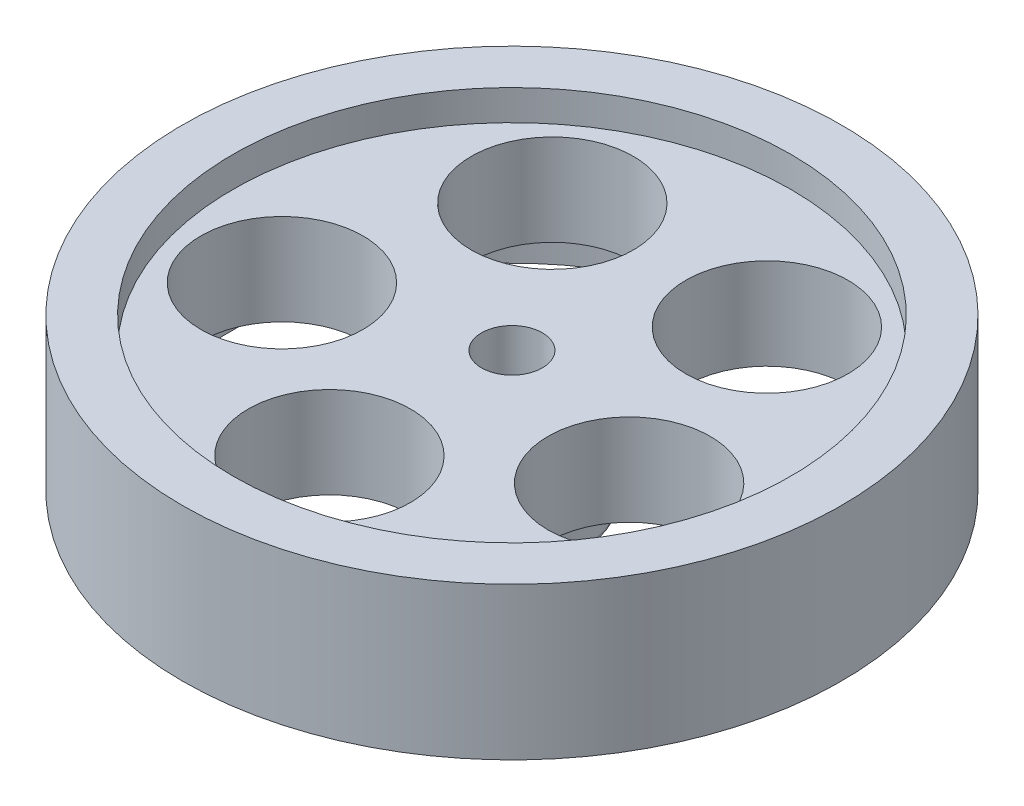
from build123d import *

# Parameters (mm, degrees)
SKETCH2_R               = 32.5
BOSS_EXTRUDE1_DEPTH     = 15
SKETCH3_R               = 27.5
CUT_EXTRUDE1_DEPTH      = 3
CUT_EXTRUDE2_START      = -12
SKETCH3_2_R             = 27.5
CUT_EXTRUDE2_DEPTH      = 3
CUT_EXTRUDE3_DEPTH      = 48.502631506
CUT_EXTRUDE3_DEPTH_BACK = 48.502631506
SKETCH4_R               = 8
SKETCH5_R               = 7.273402988
BOSS_EXTRUDE2_DEPTH     = 4.5
FILLET3_R               = 0.5
CUT_EXTRUDE4_DEPTH      = 49.833902158
CUT_EXTRUDE4_DEPTH_BACK = 49.833902158
SKETCH6_R               = 3


with BuildPart() as part:
    # Sketch2 → Boss-Extrude1 (new body)
    with BuildSketch(Plane(origin=(0, 0, 0), x_dir=(1, 0, 0), z_dir=(0, 1, 0))):
        Circle(SKETCH2_R)
    extrude(amount=BOSS_EXTRUDE1_DEPTH)

    # Sketch3 → Cut-Extrude1 (cut)
    with BuildSketch(Plane(origin=(0, 15, 0), x_dir=(1, 0, 0), z_dir=(0, 1, 0))):
        Circle(SKETCH3_R)
    extrude(amount=-CUT_EXTRUDE1_DEPTH, mode=Mode.SUBTRACT)

    # Sketch3<2> → Cut-Extrude2 (cut)
    with BuildSketch(Plane(origin=(0, 15, 0), x_dir=(1, 0, 0), z_dir=(0, 1, 0)).offset(CUT_EXTRUDE2_START)):
        Circle(SKETCH3_2_R)
    extrude(amount=-CUT_EXTRUDE2_DEPTH, mode=Mode.SUBTRACT)

    # Sketch4 → Cut-Extrude3 (cut, two sides: drawn at the far end of the back side and taken through both)
    with BuildSketch(Plane.XZ.offset(-3).offset(-CUT_EXTRUDE3_DEPTH_BACK)):
        with Locations((0, 18)):
            Circle(SKETCH4_R)
        with Locations((17.119017293, 5.562305899)):
            Circle(SKETCH4_R)
        with Locations((10.580134541, -14.562305899)):
            Circle(SKETCH4_R)
        with Locations((-10.580134541, -14.562305899)):
            Circle(SKETCH4_R)
        with Locations((-17.119017293, 5.562305899)):
            Circle(SKETCH4_R)
    extrude(amount=CUT_EXTRUDE3_DEPTH + CUT_EXTRUDE3_DEPTH_BACK, mode=Mode.SUBTRACT)

    # Sketch5 → Boss-Extrude2 (add)
    with BuildSketch(Plane.XZ.offset(-3)):
        Circle(SKETCH5_R)
    extrude(amount=BOSS_EXTRUDE2_DEPTH)

    # Fillet3
    fillet3_edges = [part.edges().sort_by_distance(p)[0] for p in [
        (-7.273402988, -1.5, 0),
    ]]
    fillet(fillet3_edges, radius=FILLET3_R)

    # Sketch6 → Cut-Extrude4 (cut, two sides: drawn at the far end of the back side and taken through both)
    with BuildSketch(Plane.XZ.offset(1.5).offset(-CUT_EXTRUDE4_DEPTH_BACK)):
        Circle(SKETCH6_R)
    extrude(amount=CUT_EXTRUDE4_DEPTH + CUT_EXTRUDE4_DEPTH_BACK, mode=Mode.SUBTRACT)


solid = part.part
